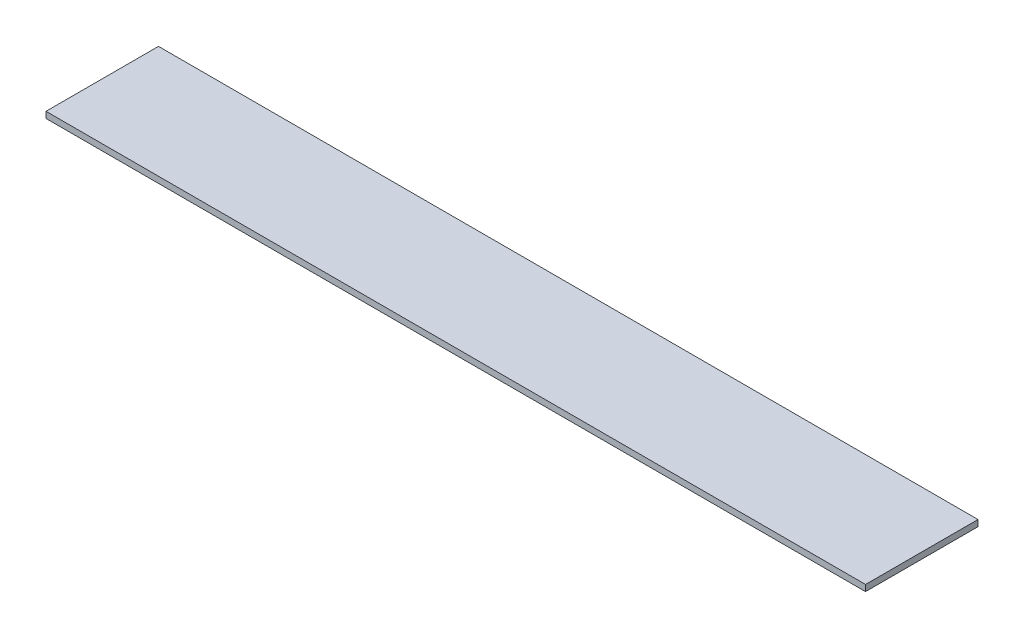
from build123d import *

# Parameters (mm, degrees)
SKETCH1_W           = 417.51504
SKETCH1_H           = 57.3
BOSS_EXTRUDE1_DEPTH = 3.175


with BuildPart() as part:
    # Sketch1 → Boss-Extrude1 (new body)
    with BuildSketch(Plane(origin=(0, 0, 0), x_dir=(1, 0, 0), z_dir=(0, 1, 0))):
        with Locations((9.107626003, 10.740125004)):
            Rectangle(SKETCH1_W, SKETCH1_H)
    extrude(amount=BOSS_EXTRUDE1_DEPTH)


solid = part.part
